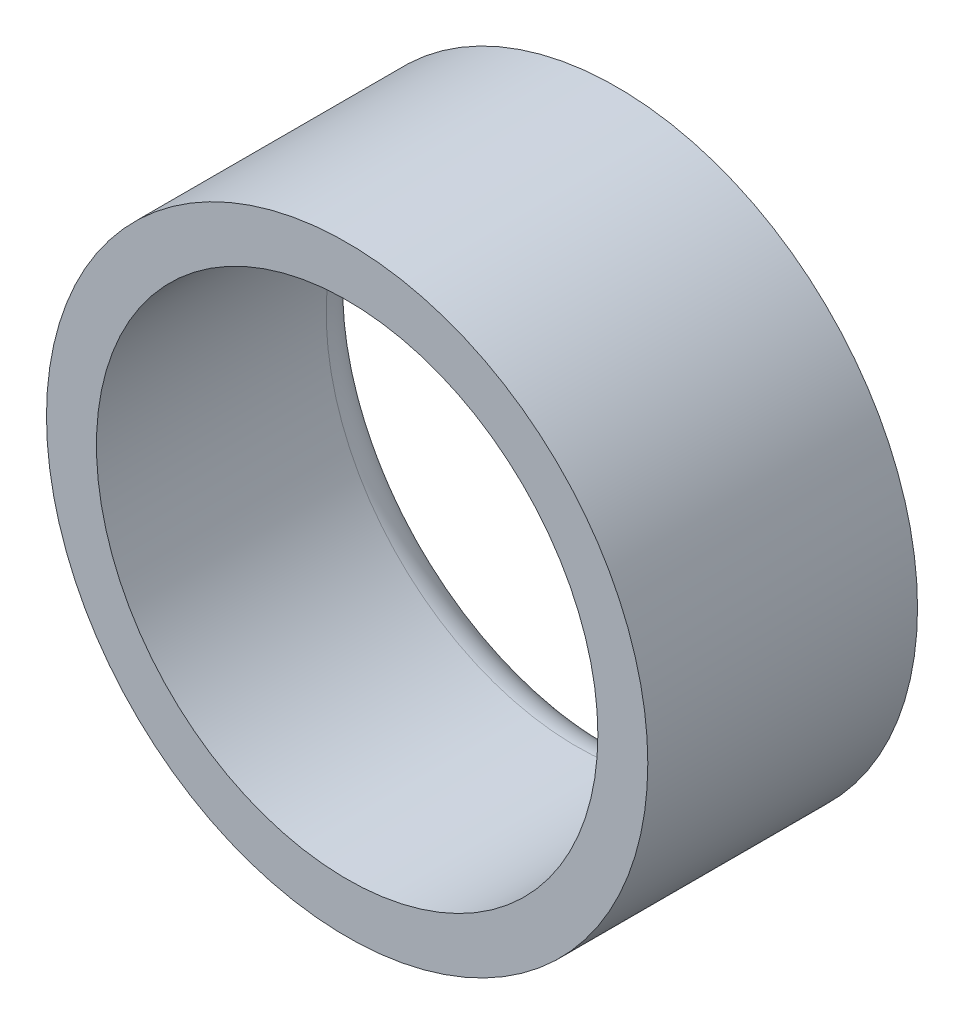
from build123d import *

# Parameters (mm, degrees)
SKETCH1_R           = 19.1135
SKETCH1_R_2         = 15.9385
BOSS_EXTRUDE1_DEPTH = 17.145
FILLET1_R           = 2.54


with BuildPart() as part:
    # Sketch1 → Boss-Extrude1 (new body)
    with BuildSketch(Plane.XY):
        Circle(SKETCH1_R)
        Circle(SKETCH1_R_2, mode=Mode.SUBTRACT)
    extrude(amount=BOSS_EXTRUDE1_DEPTH)

    # Fillet1
    fillet1_edges = [part.edges().sort_by_distance(p)[0] for p in [
        (-15.9385, 0, 0),
    ]]
    fillet(fillet1_edges, radius=FILLET1_R)


solid = part.part
